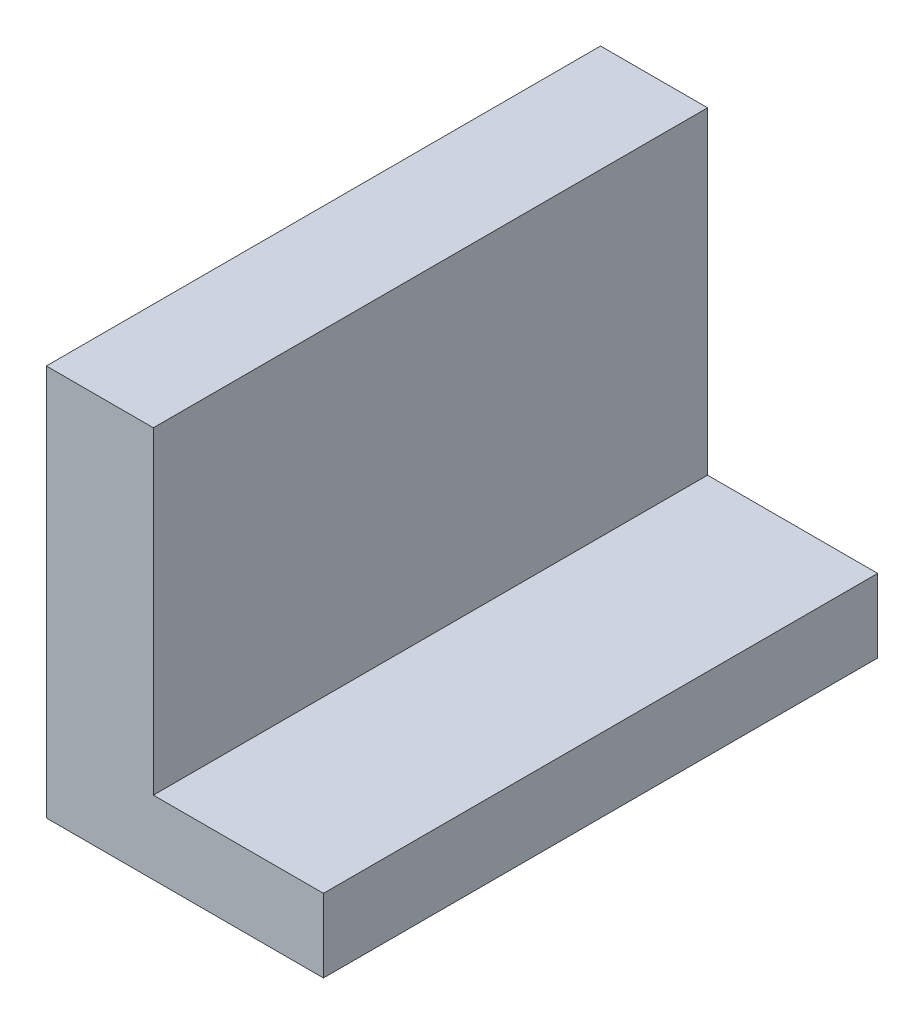
from build123d import *

# Parameters (mm, degrees)
BOSS_EXTRUDE1_DEPTH = 120


with BuildPart() as part:
    # Sketch1 → Boss-Extrude1 (new body)
    with BuildSketch(Plane.XY):
        Polygon((0, 0), (60, 0), (60, 15.873015873), (23.174603175, 15.873015873), (23.174603175, 84.761904762), (0, 84.761904762), align=None)
    extrude(amount=BOSS_EXTRUDE1_DEPTH)


solid = part.part
